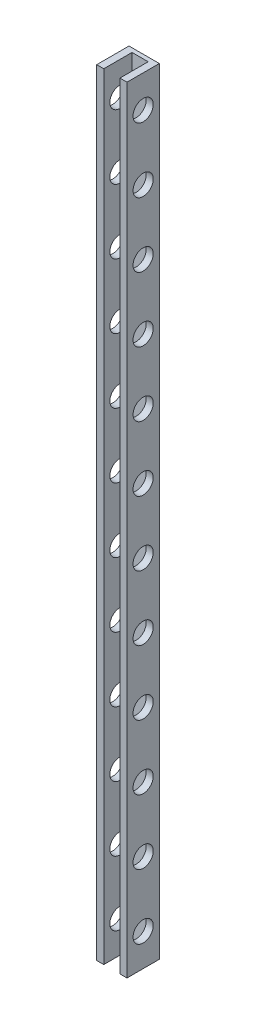
from build123d import *

# Parameters (mm, degrees)
BASE_DEPTH  = 192
ESQUISSE2_R = 2.5
TROU_DEPTH  = 193.188058942


with BuildPart() as part:
    # Esquisse1 → Base (new body)
    with BuildSketch(Plane(origin=(0, 0, 0), x_dir=(1, 0, 0), z_dir=(0, 1, 0))):
        Polygon((-2, -4), (-2, 3), (2, 3), (2, -4), (3.75, -4), (3.75, 4), (-3.75, 4), (-3.75, -4), align=None)
    extrude(amount=-BASE_DEPTH)

    # Esquisse2 → Trou (cut, through all)
    with BuildSketch(Plane.ZY.offset(3.75)):
        with Locations((0, -8)):
            Circle(ESQUISSE2_R)
        with Locations((0, -24)):
            Circle(ESQUISSE2_R)
        with Locations((0, -40)):
            Circle(ESQUISSE2_R)
        with Locations((0, -56)):
            Circle(ESQUISSE2_R)
        with Locations((0, -72)):
            Circle(ESQUISSE2_R)
        with Locations((0, -88)):
            Circle(ESQUISSE2_R)
        with Locations((0, -104)):
            Circle(ESQUISSE2_R)
        with Locations((0, -120)):
            Circle(ESQUISSE2_R)
        with Locations((0, -136)):
            Circle(ESQUISSE2_R)
        with Locations((0, -152)):
            Circle(ESQUISSE2_R)
        with Locations((0, -168)):
            Circle(ESQUISSE2_R)
        with Locations((0, -184)):
            Circle(ESQUISSE2_R)
    extrude(amount=-TROU_DEPTH, mode=Mode.SUBTRACT)


solid = part.part
